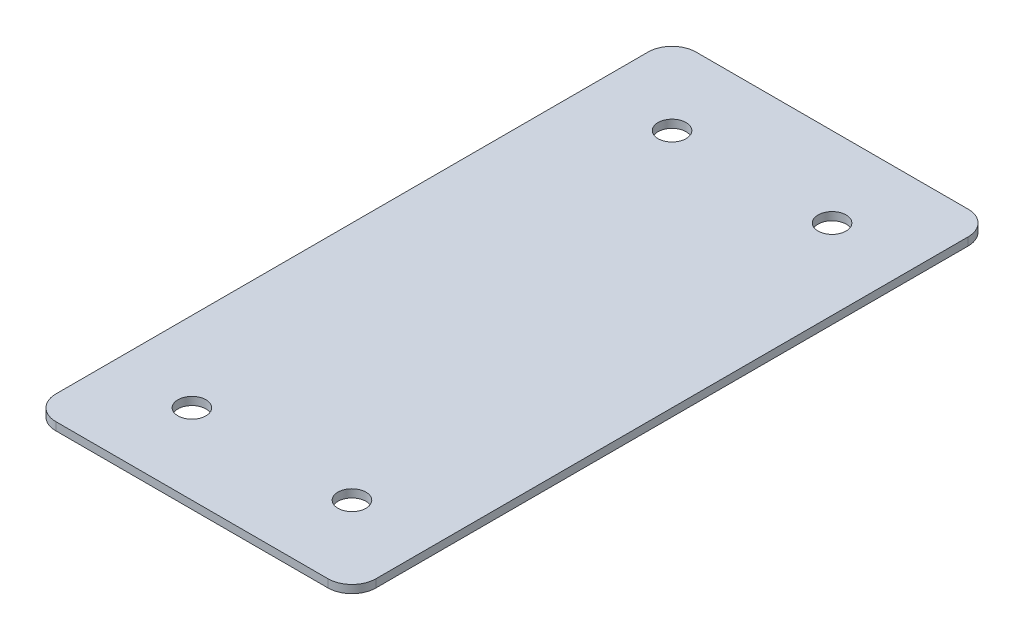
from build123d import *

# Parameters (mm, degrees)
SKETCH_1_R      = 1.75
EXTRUDE_1_DEPTH = 1
FILLET_1_R      = 3


with BuildPart() as part:
    # ｽｹｯﾁ1 → ﾎﾞｽ - 押し出し1 (new body)
    with BuildSketch(Plane(origin=(0, 0, 0), x_dir=(1, 0, 0), z_dir=(0, 1, 0))):
        Polygon((0.281416123, 39.079347488), (-19.718583877, 39.079347488), (-19.718583877, -40.920652512), (20.281416123, -40.920652512), (20.281416123, 39.079347488), align=None)
        with Locations(Location((-9.718583877, 29.079347488, 0), (0, 0, 270))):
            Circle(SKETCH_1_R, mode=Mode.SUBTRACT)
        with Locations(Location((10.281416123, 29.079347488, 0), (0, 0, 90))):
            Circle(SKETCH_1_R, mode=Mode.SUBTRACT)
        with Locations(Location((10.281416123, -30.920652512, 0), (0, 0, 270))):
            Circle(SKETCH_1_R, mode=Mode.SUBTRACT)
        with Locations(Location((-9.718583877, -30.920652512, 0), (0, 0, 90))):
            Circle(SKETCH_1_R, mode=Mode.SUBTRACT)
    extrude(amount=EXTRUDE_1_DEPTH)

    # ﾌｨﾚｯﾄ1
    fillet_1_edges = [part.edges().sort_by_distance(p)[0] for p in [
        (20.281416123, 0.5, -39.079347488),
        (20.281416123, 0.5, 40.920652512),
        (-19.718583877, 0.5, 40.920652512),
        (-19.718583877, 0.5, -39.079347488),
    ]]
    fillet(fillet_1_edges, radius=FILLET_1_R)


solid = part.part
